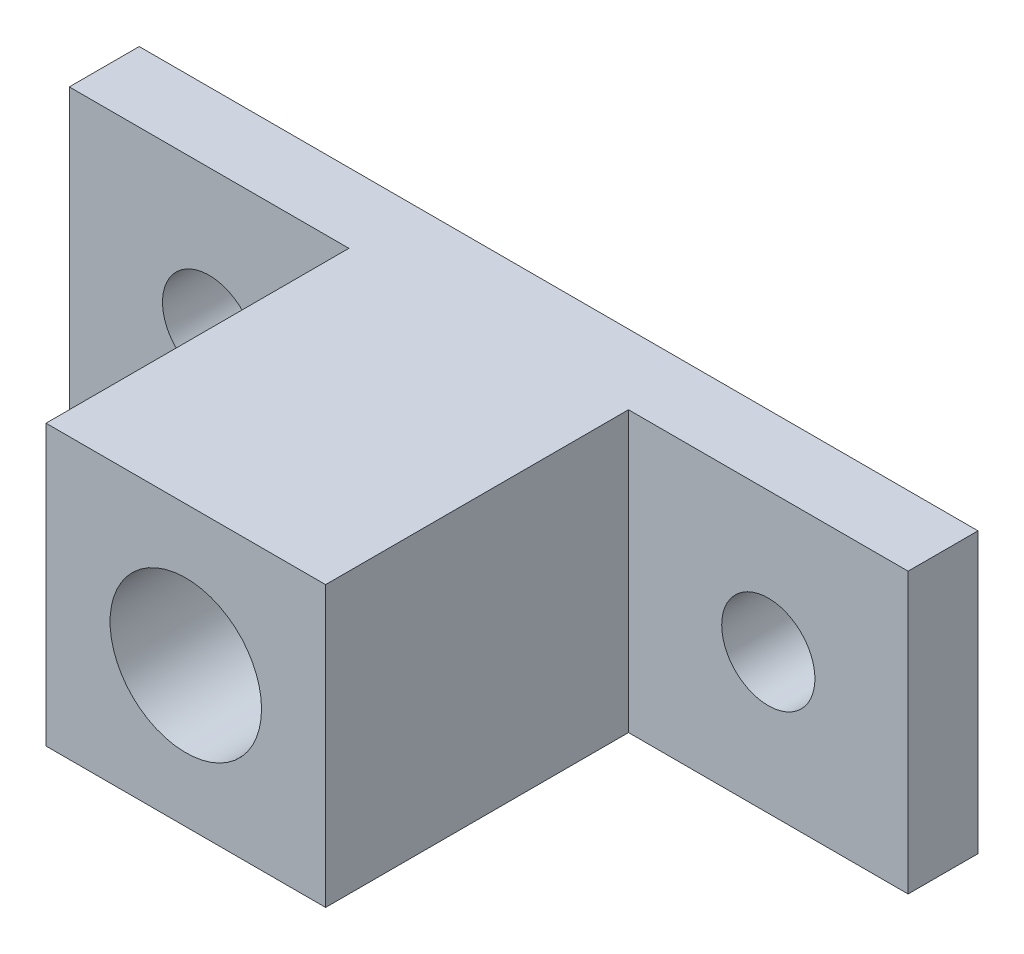
from build123d import *

# Parameters (mm, degrees)
CROQUIS1_W              = 36
CROQUIS1_H              = 12
SALIENTE_EXTRUIR1_DEPTH = 8
CROQUIS2_R              = 3.25
CORTAR_EXTRUIR1_DEPTH   = 8
CROQUIS3_W              = 12
CROQUIS3_H              = 13
CORTAR_EXTRUIR2_DEPTH   = 24.065125189
CROQUIS4_R              = 2
CORTAR_EXTRUIR3_DEPTH   = 8


with BuildPart() as part:
    # Croquis1 → Saliente-Extruir1 (new, symmetric)
    with BuildSketch(Plane.XY):
        Rectangle(CROQUIS1_W, CROQUIS1_H)
    extrude(amount=SALIENTE_EXTRUIR1_DEPTH, both=True)

    # Croquis2 → Cortar-Extruir1 (cut)
    with BuildSketch(Plane.XY.offset(8)):
        Circle(CROQUIS2_R)
    extrude(amount=-CORTAR_EXTRUIR1_DEPTH, mode=Mode.SUBTRACT)

    # Croquis3 → Cortar-Extruir2 (cut, through all)
    with BuildSketch(Plane.XZ.offset(6)):
        with Locations((-12, 1.5)):
            Rectangle(CROQUIS3_W, CROQUIS3_H)
        with Locations((12, 1.5)):
            Rectangle(CROQUIS3_W, CROQUIS3_H)
    extrude(amount=-CORTAR_EXTRUIR2_DEPTH, mode=Mode.SUBTRACT)

    # Croquis4 → Cortar-Extruir3 (cut)
    with BuildSketch(Plane.XY.offset(-5)):
        with Locations((-12, 0)):
            Circle(CROQUIS4_R)
        with Locations(Location((12, 0, 0), (0, 0, 180))):
            Circle(CROQUIS4_R)
    extrude(amount=-CORTAR_EXTRUIR3_DEPTH, mode=Mode.SUBTRACT)


solid = part.part
